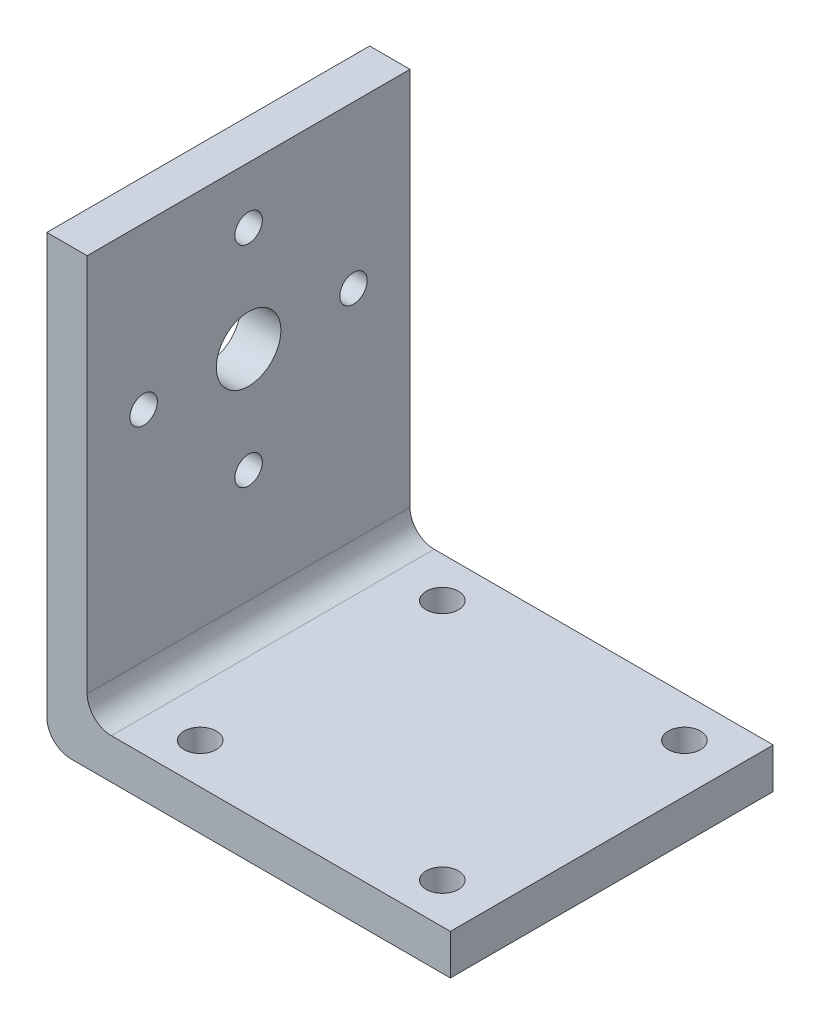
from build123d import *

# Parameters (mm, degrees)
SKETCH1_W           = 50
SKETCH1_H           = 40
BOSS_EXTRUDE1_DEPTH = 5
SKETCH2_W           = 5
SKETCH2_H           = 40
BOSS_EXTRUDE2_DEPTH = 50
FILLET1_R           = 3
CUT_EXTRUDE1_REACH  = 86.41
SKETCH3_R           = 4
CUT_EXTRUDE2_REACH  = 86.41
SKETCH5_R           = 1.7
CUT_EXTRUDE3_REACH  = 83.24
SKETCH6_R           = 2


with BuildPart() as part:
    # Sketch1 → Boss-Extrude1 (new body)
    with BuildSketch(Plane(origin=(0, 0, 0), x_dir=(1, 0, 0), z_dir=(0, 1, 0))):
        with Locations((25, -20)):
            Rectangle(SKETCH1_W, SKETCH1_H)
    extrude(amount=BOSS_EXTRUDE1_DEPTH)

    # Sketch2 → Boss-Extrude2 (add)
    with BuildSketch(Plane(origin=(0, 5, 0), x_dir=(1, 0, 0), z_dir=(0, 1, 0))):
        with Locations((2.5, -20)):
            Rectangle(SKETCH2_W, SKETCH2_H)
    extrude(amount=BOSS_EXTRUDE2_DEPTH)

    # Fillet1
    fillet1_edges = [part.edges().sort_by_distance(p)[0] for p in [
        (5, 5, 20),
        (0, 0, 20),
    ]]
    fillet(fillet1_edges, radius=FILLET1_R)

    # Sketch3 → Cut-Extrude1 (cut, up to next)
    with BuildSketch(Plane.ZY, mode=Mode.PRIVATE) as cut_extrude1_sk1:
        with Locations((20, 35)):
            Circle(SKETCH3_R)
    cut_extrude1_tool1 = extrude(cut_extrude1_sk1.sketch, amount=-CUT_EXTRUDE1_REACH, mode=Mode.PRIVATE) & part.part
    add(cut_extrude1_tool1.solids().sort_by_distance((0, 35, 20))[0], mode=Mode.SUBTRACT)

    # Sketch5 → Cut-Extrude2 (cut, up to next)
    with BuildSketch(Plane.ZY, mode=Mode.PRIVATE) as cut_extrude2_sk1:
        with Locations((7, 35)):
            Circle(SKETCH5_R)
    cut_extrude2_tool1 = extrude(cut_extrude2_sk1.sketch, amount=-CUT_EXTRUDE2_REACH, mode=Mode.PRIVATE) & part.part
    # Sketch5 → Cut-Extrude2 (cut, up to next)
    with BuildSketch(Plane.ZY, mode=Mode.PRIVATE) as cut_extrude2_sk2:
        with Locations((33, 35)):
            Circle(SKETCH5_R)
    cut_extrude2_tool2 = extrude(cut_extrude2_sk2.sketch, amount=-CUT_EXTRUDE2_REACH, mode=Mode.PRIVATE) & part.part
    # Sketch5 → Cut-Extrude2 (cut, up to next)
    with BuildSketch(Plane.ZY, mode=Mode.PRIVATE) as cut_extrude2_sk3:
        with Locations((20, 48)):
            Circle(SKETCH5_R)
    cut_extrude2_tool3 = extrude(cut_extrude2_sk3.sketch, amount=-CUT_EXTRUDE2_REACH, mode=Mode.PRIVATE) & part.part
    # Sketch5 → Cut-Extrude2 (cut, up to next)
    with BuildSketch(Plane.ZY, mode=Mode.PRIVATE) as cut_extrude2_sk4:
        with Locations((20, 22)):
            Circle(SKETCH5_R)
    cut_extrude2_tool4 = extrude(cut_extrude2_sk4.sketch, amount=-CUT_EXTRUDE2_REACH, mode=Mode.PRIVATE) & part.part
    add(cut_extrude2_tool1.solids().sort_by_distance((0, 35, 7))[0], mode=Mode.SUBTRACT)
    add(cut_extrude2_tool2.solids().sort_by_distance((0, 35, 33))[0], mode=Mode.SUBTRACT)
    add(cut_extrude2_tool3.solids().sort_by_distance((0, 48, 20))[0], mode=Mode.SUBTRACT)
    add(cut_extrude2_tool4.solids().sort_by_distance((0, 22, 20))[0], mode=Mode.SUBTRACT)

    # Sketch6 → Cut-Extrude3 (cut, up to next)
    with BuildSketch(Plane(origin=(0, 5, 0), x_dir=(1, 0, 0), z_dir=(0, 1, 0)), mode=Mode.PRIVATE) as cut_extrude3_sk1:
        with Locations(Location((14, -5, 0), (0, 0, 270))):
            Circle(SKETCH6_R)
    cut_extrude3_tool1 = extrude(cut_extrude3_sk1.sketch, amount=-CUT_EXTRUDE3_REACH, mode=Mode.PRIVATE) & part.part
    # Sketch6 → Cut-Extrude3 (cut, up to next)
    with BuildSketch(Plane(origin=(0, 5, 0), x_dir=(1, 0, 0), z_dir=(0, 1, 0)), mode=Mode.PRIVATE) as cut_extrude3_sk2:
        with Locations(Location((14, -35, 0), (0, 0, 270))):
            Circle(SKETCH6_R)
    cut_extrude3_tool2 = extrude(cut_extrude3_sk2.sketch, amount=-CUT_EXTRUDE3_REACH, mode=Mode.PRIVATE) & part.part
    # Sketch6 → Cut-Extrude3 (cut, up to next)
    with BuildSketch(Plane(origin=(0, 5, 0), x_dir=(1, 0, 0), z_dir=(0, 1, 0)), mode=Mode.PRIVATE) as cut_extrude3_sk3:
        with Locations(Location((44, -5, 0), (0, 0, 270))):
            Circle(SKETCH6_R)
    cut_extrude3_tool3 = extrude(cut_extrude3_sk3.sketch, amount=-CUT_EXTRUDE3_REACH, mode=Mode.PRIVATE) & part.part
    # Sketch6 → Cut-Extrude3 (cut, up to next)
    with BuildSketch(Plane(origin=(0, 5, 0), x_dir=(1, 0, 0), z_dir=(0, 1, 0)), mode=Mode.PRIVATE) as cut_extrude3_sk4:
        with Locations(Location((44, -35, 0), (0, 0, 270))):
            Circle(SKETCH6_R)
    cut_extrude3_tool4 = extrude(cut_extrude3_sk4.sketch, amount=-CUT_EXTRUDE3_REACH, mode=Mode.PRIVATE) & part.part
    add(cut_extrude3_tool1.solids().sort_by_distance((14, 5, 5))[0], mode=Mode.SUBTRACT)
    add(cut_extrude3_tool2.solids().sort_by_distance((14, 5, 35))[0], mode=Mode.SUBTRACT)
    add(cut_extrude3_tool3.solids().sort_by_distance((44, 5, 5))[0], mode=Mode.SUBTRACT)
    add(cut_extrude3_tool4.solids().sort_by_distance((44, 5, 35))[0], mode=Mode.SUBTRACT)


solid = part.part
